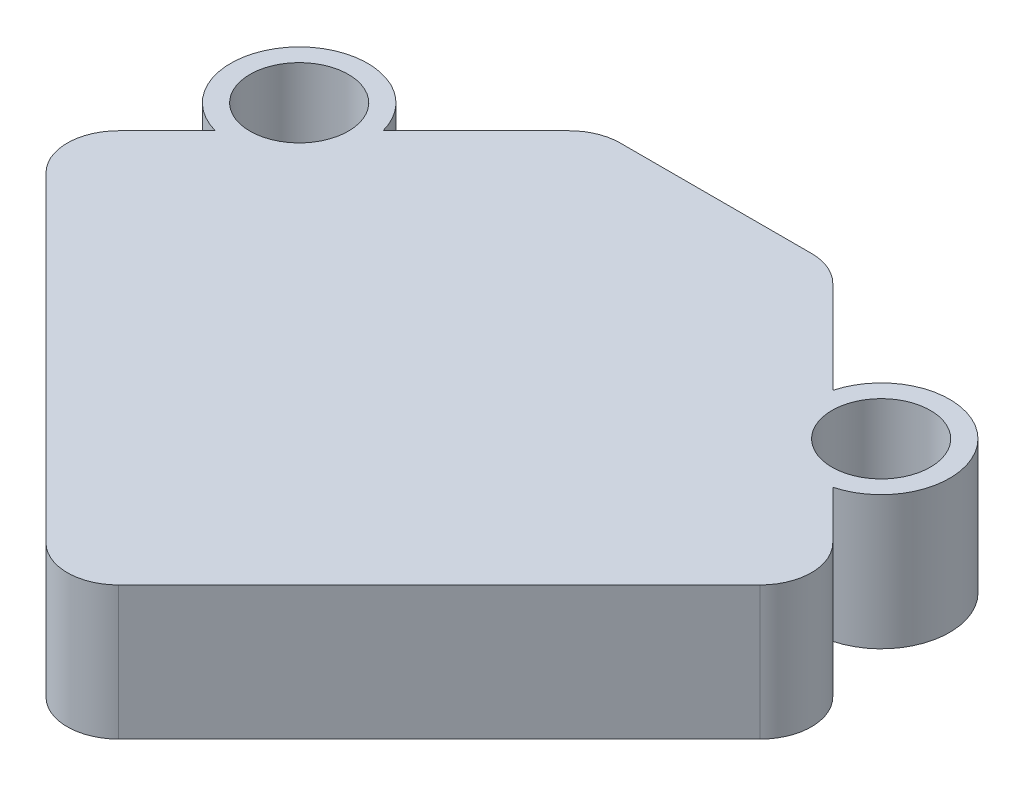
from build123d import *

# Parameters (mm, degrees)
SKETCH1_R           = 4
SKETCH1_R_2         = 1.75
BOSS_EXTRUDE1_DEPTH = 7
SKETCH2_R           = 2.875
CUT_EXTRUDE1_DEPTH  = 5
CUT_EXTRUDE3_REACH  = 35.245
SKETCH4_W           = 13.65685425
SKETCH4_H           = 6.828427125
SKETCH5_R           = 2.875
BOSS_EXTRUDE2_DEPTH = 0.8
FILLET1_R           = 3


with BuildPart() as part:
    # Sketch1 → Boss-Extrude1 (new body)
    # profile 1 of 3: a face of its own
    with BuildSketch(Plane(origin=(0, 0, 0), x_dir=(1, 0, 0), z_dir=(0, 1, 0))):
        with Locations((-17, 8.809397513)):
            Circle(SKETCH1_R)
        with Locations(Location((-17, 8.809397513, 0), (0, 0, 270))):
            Circle(SKETCH1_R_2, mode=Mode.SUBTRACT)
    # profile 2 of 3: a face of its own
    with BuildSketch(Plane(origin=(0, 0, 0), x_dir=(1, 0, 0), z_dir=(0, 1, 0))):
        with Locations((17, 8.809397513)):
            Circle(SKETCH1_R)
        with Locations(Location((17, 8.809397513, 0), (0, 0, 270))):
            Circle(SKETCH1_R_2, mode=Mode.SUBTRACT)
    # profile 3 of 3: a face of its own
    with BuildSketch(Plane(origin=(0, 0, 0), x_dir=(1, 0, 0), z_dir=(0, 1, 0))):
        Polygon((-22.980970389, 0), (0, -22.980970389), (22.980970389, 0), (0, 22.980970389), align=None)
        Polygon((-20.152543264, 0), (0, -20.152543264), (20.152543264, 0), (0, 20.152543264), align=None, mode=Mode.SUBTRACT)
    extrude(amount=BOSS_EXTRUDE1_DEPTH)

    # Sketch2 → Cut-Extrude1 (cut)
    with BuildSketch(Plane(origin=(0, 7, 0), x_dir=(1, 0, 0), z_dir=(0, 1, 0))):
        with Locations(Location((-17, 8.809397513, 0), (0, 0, 270))):
            Circle(SKETCH2_R)
        with Locations(Location((17, 8.809397513, 0), (0, 0, 270))):
            Circle(SKETCH2_R)
    extrude(amount=-CUT_EXTRUDE1_DEPTH, mode=Mode.SUBTRACT)

    # Sketch4 → Cut-Extrude3 (cut, up to next)
    with BuildSketch(Plane(origin=(0, 7, 0), x_dir=(1, 0, 0), z_dir=(0, 1, 0)), mode=Mode.PRIVATE) as cut_extrude3_sk1:
        with Locations((0, 19.566756827)):
            Rectangle(SKETCH4_W, SKETCH4_H)
    cut_extrude3_tool1 = extrude(cut_extrude3_sk1.sketch, amount=-CUT_EXTRUDE3_REACH, mode=Mode.PRIVATE) & part.part
    add(cut_extrude3_tool1.solids().sort_by_distance((0, 7, -19.566757))[0], mode=Mode.SUBTRACT)

    # Sketch5 → Boss-Extrude2 (add)
    # profile 1 of 2: a face of its own
    with BuildSketch(Plane(origin=(0, 7, 0), x_dir=(1, 0, 0), z_dir=(0, 1, 0))):
        with BuildLine():
            Line((13.136296695, 9.844673694), (6.828427125, 16.152543264))
            Line((6.828427125, 16.152543264), (4, 16.152543264))
            Line((4, 16.152543264), (20.152543264, 0))
            Line((20.152543264, 0), (0, -20.152543264))
            Line((0, -20.152543264), (-20.152543264, 0))
            Line((-20.152543264, 0), (-4, 16.152543264))
            Line((-4, 16.152543264), (-6.828427125, 16.152543264))
            Line((-6.828427125, 16.152543264), (-13.136296695, 9.844673694))
            ThreePointArc((-13.136296695, 9.844673694), (-19.828427125, 11.637824638), (-18.03527618, 4.945694208))
            Line((-18.03527618, 4.945694208), (-22.980970389, 0))
            Line((-22.980970389, 0), (0, -22.980970389))
            Line((0, -22.980970389), (22.980970389, 0))
            Line((22.980970389, 0), (18.03527618, 4.945694208))
            ThreePointArc((18.03527618, 4.945694208), (19.828427125, 11.637824638), (13.136296695, 9.844673694))
        make_face()
        with Locations(Location((17, 8.809397513, 0), (0, 0, 270))):
            Circle(SKETCH5_R, mode=Mode.SUBTRACT)
        with Locations(Location((-17, 8.809397513, 0), (0, 0, 270))):
            Circle(SKETCH5_R, mode=Mode.SUBTRACT)
    # profile 2 of 2: a face of its own
    with BuildSketch(Plane(origin=(0, 7, 0), x_dir=(1, 0, 0), z_dir=(0, 1, 0))):
        Polygon((-4, 16.152543264), (4, 16.152543264), (20.152543264, 0), (0, -20.152543264), (-20.152543264, 0), align=None)
    extrude(amount=BOSS_EXTRUDE2_DEPTH)

    # Fillet1
    fillet1_edges = [part.edges().sort_by_distance(p)[0] for p in [
        (22.980970389, 3.9, 0),
        (0, 3.9, 22.980970389),
        (-22.980970389, 3.9, 0),
        (6.828427125, 3.9, -16.152543264),
        (-6.828427125, 3.9, -16.152543264),
    ]]
    fillet(fillet1_edges, radius=FILLET1_R)


solid = part.part
